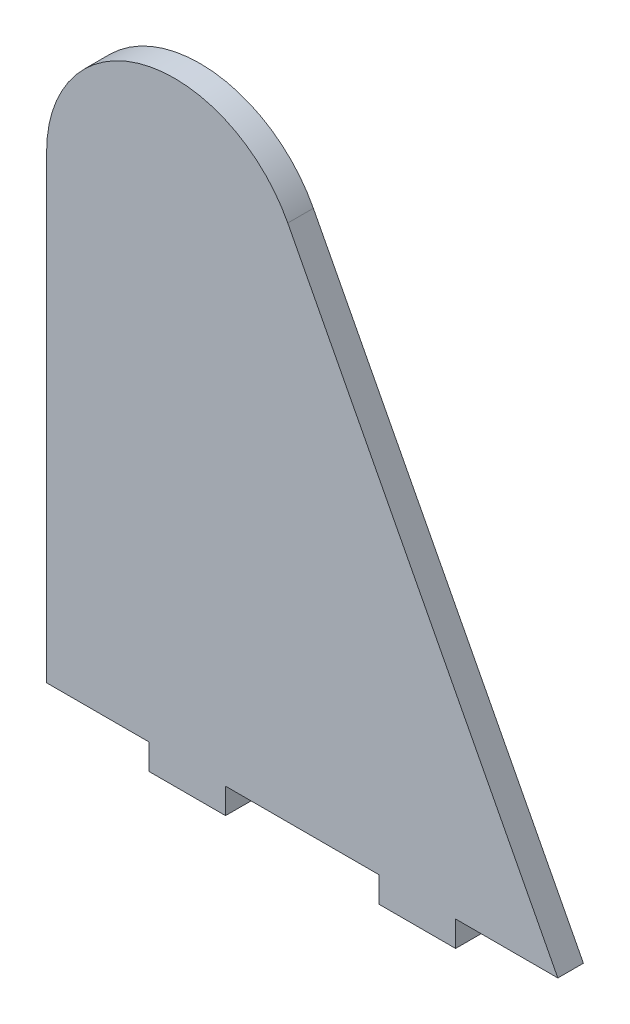
from build123d import *

# Parameters (mm, degrees)
BOSS_EXTRUDE1_DEPTH = 5


with BuildPart() as part:
    # Sketch1 → Boss-Extrude1 (new body)
    with BuildSketch(Plane.XY):
        with BuildLine():
            Line((0, 89.931645268), (0, 0))
            Line((0, 0), (20, 0))
            Line((20, 0), (20, -5))
            Line((20, -5), (35, -5))
            Line((35, -5), (35, 0))
            Line((35, 0), (65, 0))
            Line((65, 0), (65, -5))
            Line((65, -5), (80, -5))
            Line((80, -5), (80, 0))
            Line((80, 0), (100, 0))
            Line((100, 0), (47.175270829, 101.475360599))
            ThreePointArc((47.175270829, 101.475360599), (19.057852692, 114.215197013), (0, 89.931645268))
        make_face()
    extrude(amount=BOSS_EXTRUDE1_DEPTH)


solid = part.part
